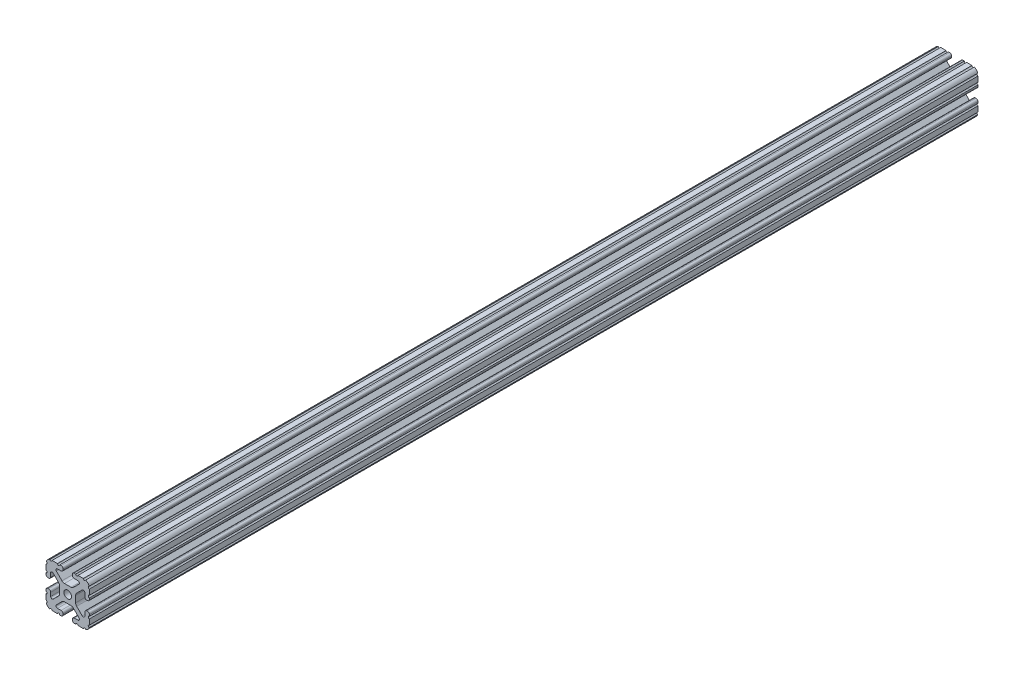
from build123d import *

# Parameters (mm, degrees)
BOSS_EXTRUDE1_DEPTH     = 390
CUT_EXTRUDE1_DEPTH      = 391.929411787
CUT_EXTRUDE1_DEPTH_BACK = 391.929411787
SKETCH5_R               = 1.016


with BuildPart() as part:
    # Sketch4 → Boss-Extrude1 (new, symmetric)
    with BuildSketch(Plane.XY):
        with BuildLine():
            Line((5.7912, -19.05), (14.3002, -19.05))
            ThreePointArc((14.3002, -19.05), (17.658815789, -17.658815789), (19.05, -14.3002))
            Line((19.05, -14.3002), (19.05, -5.7912))
            ThreePointArc((19.05, -5.7912), (18.544114832, -4.569885168), (17.3228, -4.064))
            Line((17.3228, -4.064), (16.7132, -4.064))
            ThreePointArc((16.7132, -4.064), (15.491885168, -4.569885168), (14.986, -5.7912))
            Line((14.986, -5.7912), (14.986, -8.996305235))
            ThreePointArc((14.986, -8.996305235), (14.189232738, -10.188751711), (12.782646215, -9.908964256))
            Line((12.782646215, -9.908964256), (7.888897763, -5.015215804))
            ThreePointArc((7.888897763, -5.015215804), (7.219915375, -4.014012907), (6.985, -2.833013566))
            Line((6.985, -2.833013566), (6.985, 0))
            Line((6.985, 0), (3.3274, 0))
            ThreePointArc((3.3274, 0), (2.352827104, -2.352827104), (0, -3.3274))
            Line((0, -3.3274), (0, -6.985))
            Line((0, -6.985), (2.833013566, -6.985))
            ThreePointArc((2.833013566, -6.985), (4.014012907, -7.219915375), (5.015215804, -7.888897763))
            Line((5.015215804, -7.888897763), (9.908964256, -12.782646215))
            ThreePointArc((9.908964256, -12.782646215), (10.188751711, -14.189232738), (8.996305235, -14.986))
            Line((8.996305235, -14.986), (5.7912, -14.986))
            ThreePointArc((5.7912, -14.986), (4.569885168, -15.491885168), (4.064, -16.7132))
            Line((4.064, -16.7132), (4.064, -17.3228))
            ThreePointArc((4.064, -17.3228), (4.569885168, -18.544114832), (5.7912, -19.05))
        make_face()
    extrude(amount=BOSS_EXTRUDE1_DEPTH, both=True)

    # Sketch5 → Cut-Extrude1 (cut, two sides: drawn at the far end of the back side and taken through both)
    with BuildSketch(Plane.XY.offset(-CUT_EXTRUDE1_DEPTH_BACK)):
        with Locations((14.739477062, -19.05)):
            Circle(SKETCH5_R)
        with Locations((7.980305235, -19.05)):
            Circle(SKETCH5_R)
        with Locations((19.05, -14.739477062)):
            Circle(SKETCH5_R)
        with Locations((19.05, -7.980305235)):
            Circle(SKETCH5_R)
    extrude(amount=CUT_EXTRUDE1_DEPTH + CUT_EXTRUDE1_DEPTH_BACK, mode=Mode.SUBTRACT)

    # Mirror1: part across plane


with BuildPart() as part_1:
    add(part.part)
    add(part.part.mirror(Plane(origin=(0, 0, 0), x_dir=(0, 0, 1), z_dir=(1, 0, 0))))

    # Mirror2: part across plane


with BuildPart() as part_2:
    add(part_1.part)
    add(part_1.part.mirror(Plane.ZX))


solid = part_2.part
